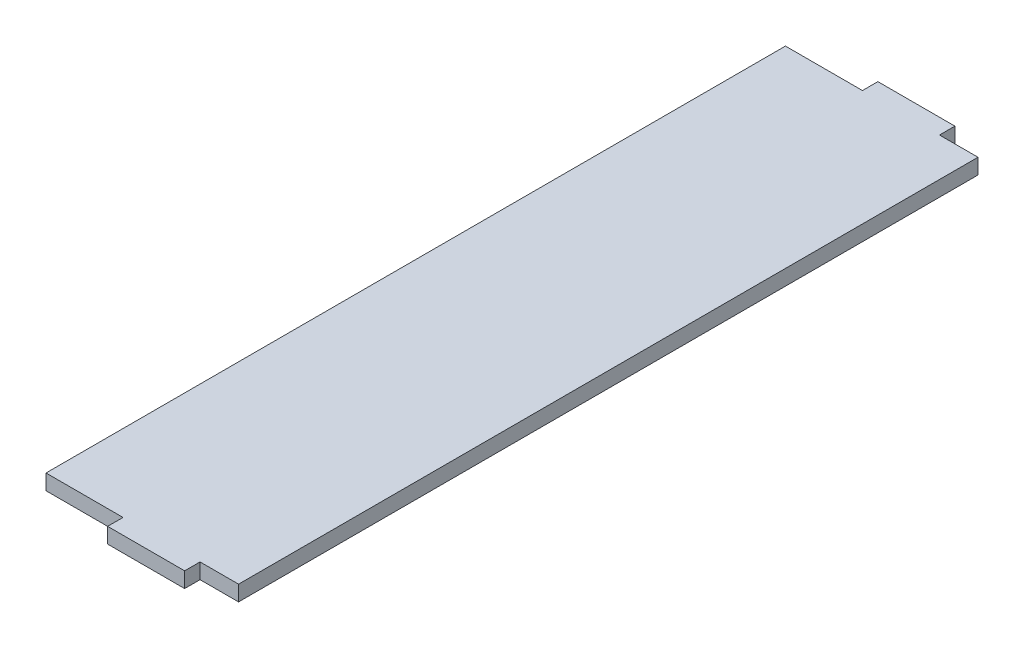
from build123d import *

# Parameters (mm, degrees)
EXTRUDE_1_DEPTH = 6


with BuildPart() as part:
    # 草图2 → 凸台-拉伸1 (new body)
    with BuildSketch(Plane(origin=(0, 0, 0), x_dir=(1, 0, 0), z_dir=(0, 1, 0))):
        Polygon((0, 0), (0, 288), (30, 288), (30, 294), (60, 294), (60, 288), (75, 288), (75, 0), (60, 0), (60, -6), (30, -6), (30, 0), align=None)
    extrude(amount=EXTRUDE_1_DEPTH)


solid = part.part
